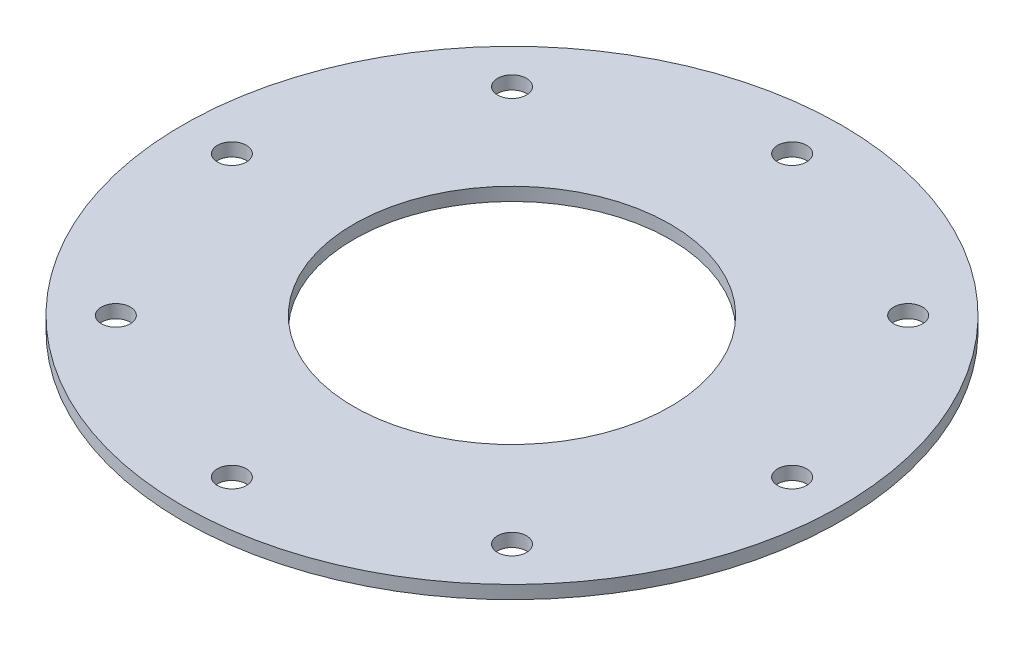
from build123d import *

# Parameters (mm, degrees)
SKETCH_1_R      = 100
SKETCH_1_R_2    = 48
SKETCH_1_R_3    = 4.4
EXTRUDE_1_DEPTH = 4


with BuildPart() as part:
    # Эскиз1 → Бобышка-Вытянуть1 (new body)
    with BuildSketch(Plane(origin=(0, 0, 0), x_dir=(1, 0, 0), z_dir=(0, 1, 0))):
        with Locations(Location((0, 0, 0), (0, 0, 90))):
            Circle(SKETCH_1_R)
        with Locations(Location((0, 0, 0), (0, 0, 90))):
            Circle(SKETCH_1_R_2, mode=Mode.SUBTRACT)
        with Locations(Location((85, 0, 0), (0, 0, 90))):
            Circle(SKETCH_1_R_3, mode=Mode.SUBTRACT)
        with Locations(Location((60.104076401, -60.104076401, 0), (0, 0, 90))):
            Circle(SKETCH_1_R_3, mode=Mode.SUBTRACT)
        with Locations(Location((0, -85, 0), (0, 0, 90))):
            Circle(SKETCH_1_R_3, mode=Mode.SUBTRACT)
        with Locations(Location((-60.104076401, -60.104076401, 0), (0, 0, 90))):
            Circle(SKETCH_1_R_3, mode=Mode.SUBTRACT)
        with Locations(Location((-85, 0, 0), (0, 0, 90))):
            Circle(SKETCH_1_R_3, mode=Mode.SUBTRACT)
        with Locations(Location((-60.104076401, 60.104076401, 0), (0, 0, 90))):
            Circle(SKETCH_1_R_3, mode=Mode.SUBTRACT)
        with Locations(Location((0, 85, 0), (0, 0, 90))):
            Circle(SKETCH_1_R_3, mode=Mode.SUBTRACT)
        with Locations(Location((60.104076401, 60.104076401, 0), (0, 0, 90))):
            Circle(SKETCH_1_R_3, mode=Mode.SUBTRACT)
    extrude(amount=EXTRUDE_1_DEPTH)


solid = part.part
